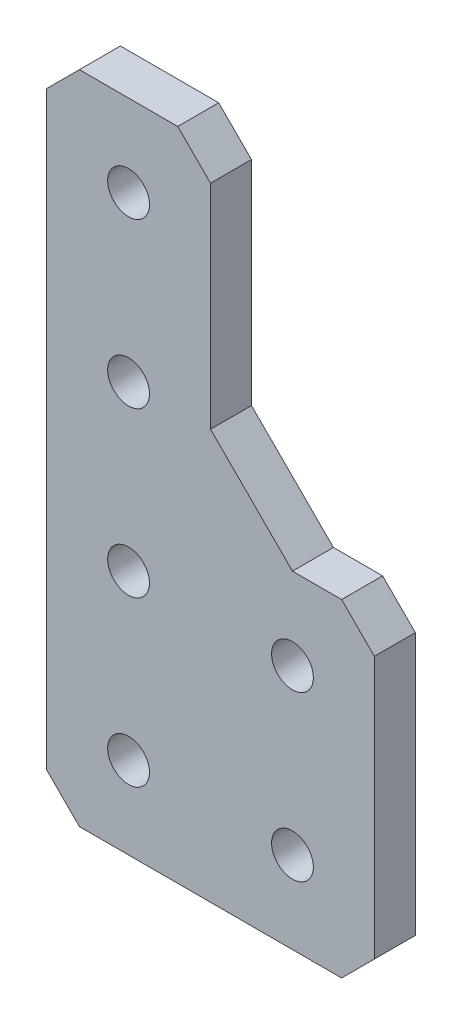
from build123d import *

# Parameters (mm, degrees)
BOSS_EXTRUDE1_DEPTH = 5
SKETCH2_R           = 2.55
CUT_EXTRUDE1_DEPTH  = 10
CHAMFER1_SIZE       = 10
CHAMFER2_SIZE       = 4
CHAMFER3_SIZE       = 4


with BuildPart() as part:
    # Sketch1 → Boss-Extrude1 (new body)
    with BuildSketch(Plane.XY):
        Polygon((0, 0), (0, 80), (20, 80), (20, 40), (40, 40), (40, 0), align=None)
    extrude(amount=BOSS_EXTRUDE1_DEPTH)

    # Sketch2 → Cut-Extrude1 (cut)
    with BuildSketch(Plane.XY.offset(5)):
        with Locations((10, 70)):
            Circle(SKETCH2_R)
        with Locations((10, 50)):
            Circle(SKETCH2_R)
        with Locations((10, 30)):
            Circle(SKETCH2_R)
        with Locations((10, 10)):
            Circle(SKETCH2_R)
        with Locations((30, 30)):
            Circle(SKETCH2_R)
        with Locations((30, 10)):
            Circle(SKETCH2_R)
    extrude(amount=-CUT_EXTRUDE1_DEPTH, mode=Mode.SUBTRACT)

    # Chamfer1
    chamfer1_edges = [part.edges().sort_by_distance(p)[0] for p in [
        (20, 40, 2.5),
    ]]
    chamfer(chamfer1_edges, length=CHAMFER1_SIZE)

    # Chamfer2
    chamfer2_edges = [part.edges().sort_by_distance(p)[0] for p in [
        (20, 80, 2.5),
    ]]
    chamfer(chamfer2_edges, length=CHAMFER2_SIZE)

    # Chamfer3
    chamfer3_edges = [part.edges().sort_by_distance(p)[0] for p in [
        (0, 0, 2.5),
        (0, 80, 2.5),
        (40, 40, 2.5),
        (40, 0, 2.5),
    ]]
    chamfer(chamfer3_edges, length=CHAMFER3_SIZE)


solid = part.part
